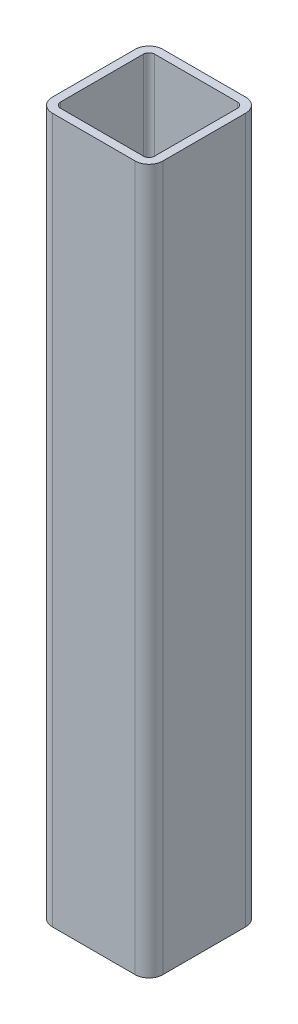
from build123d import *

# Parameters (mm, degrees)
EXTRUDE_THIN1_DEPTH = 127.5


with BuildPart() as part:
    # Sketch1 → Extrude-Thin1 (new, symmetric)
    with BuildSketch(Plane(origin=(0, 0, 0), x_dir=(1, 0, 0), z_dir=(0, 1, 0))):
        with BuildLine():
            Line((-20, 15), (-20, -15))
            ThreePointArc((-20, -15), (-18.535533906, -18.535533906), (-15, -20))
            Line((-15, -20), (15, -20))
            ThreePointArc((15, -20), (18.535533906, -18.535533906), (20, -15))
            Line((20, -15), (20, 15))
            ThreePointArc((20, 15), (18.535533906, 18.535533906), (15, 20))
            Line((15, 20), (-15, 20))
            ThreePointArc((-15, 20), (-18.535533906, 18.535533906), (-20, 15))
        make_face()
        with BuildLine():
            Line((-17, 15), (-17, -15))
            ThreePointArc((-17, -15), (-16.414213562, -16.414213562), (-15, -17))
            Line((-15, -17), (15, -17))
            ThreePointArc((15, -17), (16.414213562, -16.414213562), (17, -15))
            Line((17, -15), (17, 15))
            ThreePointArc((17, 15), (16.414213562, 16.414213562), (15, 17))
            Line((15, 17), (-15, 17))
            ThreePointArc((-15, 17), (-16.414213562, 16.414213562), (-17, 15))
        make_face(mode=Mode.SUBTRACT)
    extrude(amount=EXTRUDE_THIN1_DEPTH, both=True)


solid = part.part
